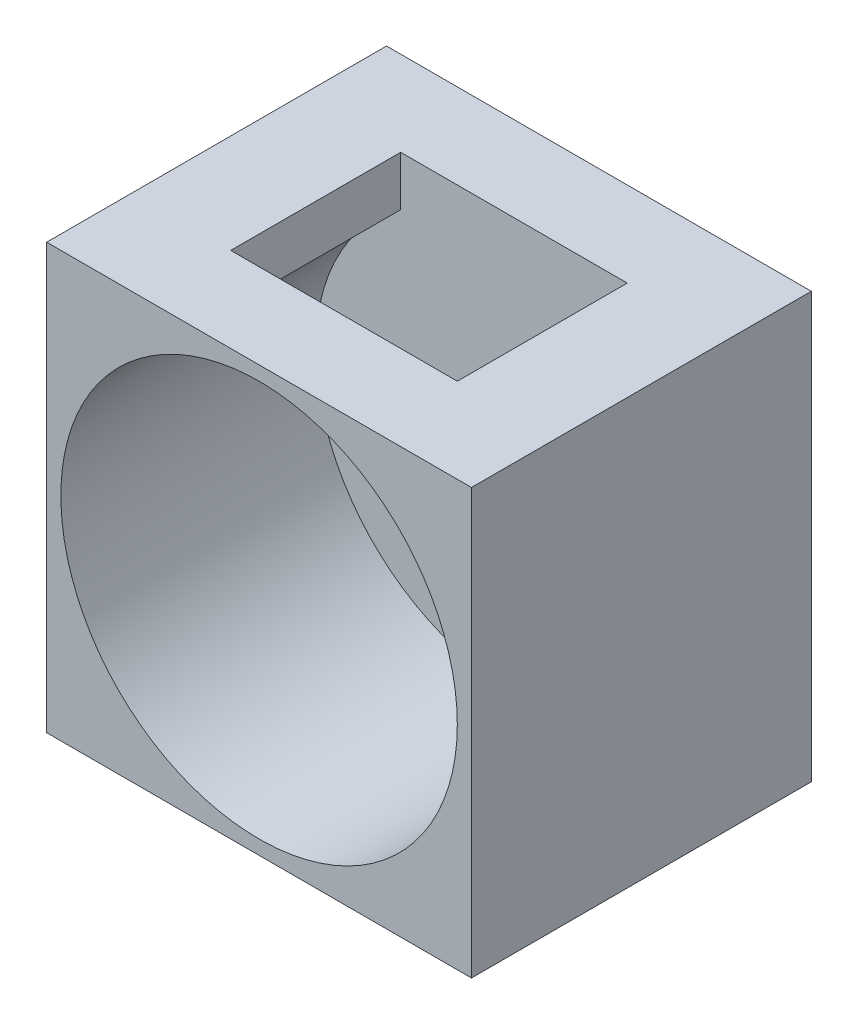
from build123d import *

# Parameters (mm, degrees)
CROQUIS1_W              = 15
CROQUIS1_H              = 15
SALIENTE_EXTRUIR1_DEPTH = 12
CROQUIS2_W              = 8
CROQUIS2_H              = 6
CORTAR_EXTRUIR1_DEPTH   = 10
CROQUIS3_R              = 7
CORTAR_EXTRUIR2_DEPTH   = 9


with BuildPart() as part:
    # Croquis1 → Saliente-Extruir1 (new body)
    with BuildSketch(Plane.XY):
        Rectangle(CROQUIS1_W, CROQUIS1_H)
    extrude(amount=SALIENTE_EXTRUIR1_DEPTH)

    # Croquis2 → Cortar-Extruir1 (cut)
    with BuildSketch(Plane(origin=(0, 7.5, 0), x_dir=(1, 0, 0), z_dir=(0, 1, 0))):
        with Locations((0, -6)):
            Rectangle(CROQUIS2_W, CROQUIS2_H)
    extrude(amount=-CORTAR_EXTRUIR1_DEPTH, mode=Mode.SUBTRACT)

    # Croquis3 → Cortar-Extruir2 (cut)
    with BuildSketch(Plane.XY.offset(12)):
        Circle(CROQUIS3_R)
    extrude(amount=-CORTAR_EXTRUIR2_DEPTH, mode=Mode.SUBTRACT)


solid = part.part
